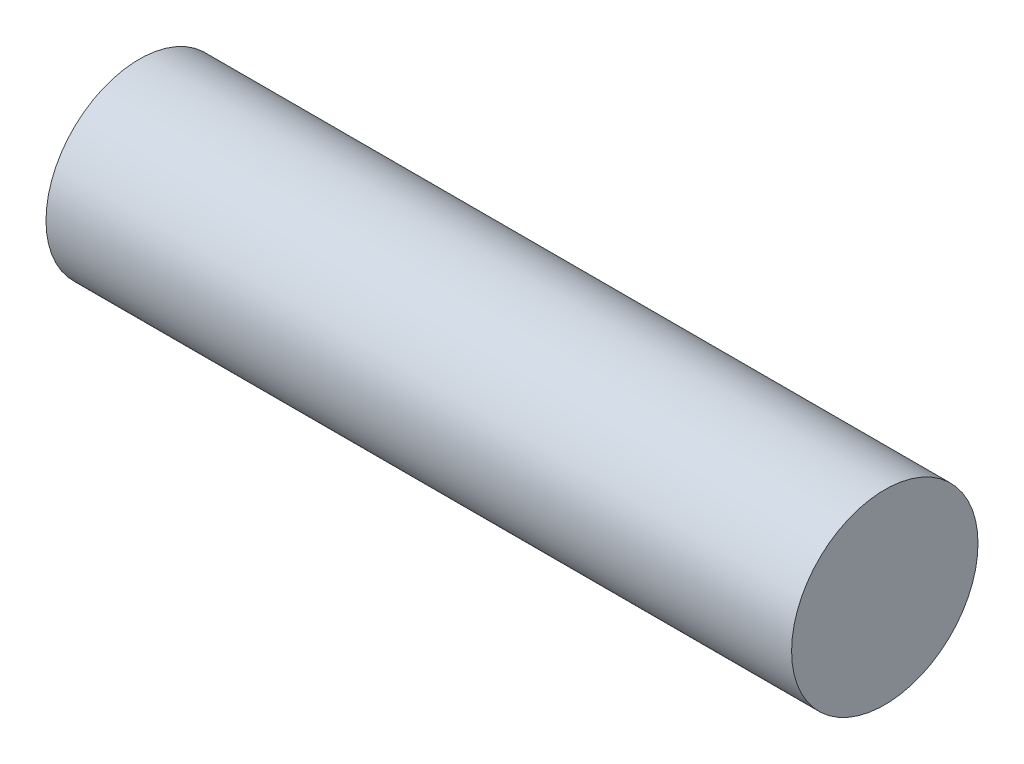
from build123d import *

# Parameters (mm, degrees)
SKETCH1_R           = 3.175
BOSS_EXTRUDE1_DEPTH = 12.7


with BuildPart() as part:
    # Sketch1 → Boss-Extrude1 (new, symmetric)
    with BuildSketch(Plane(origin=(0, 0, 0), x_dir=(0, 0, -1), z_dir=(1, 0, 0))):
        Circle(SKETCH1_R)
    extrude(amount=BOSS_EXTRUDE1_DEPTH, both=True)


solid = part.part
